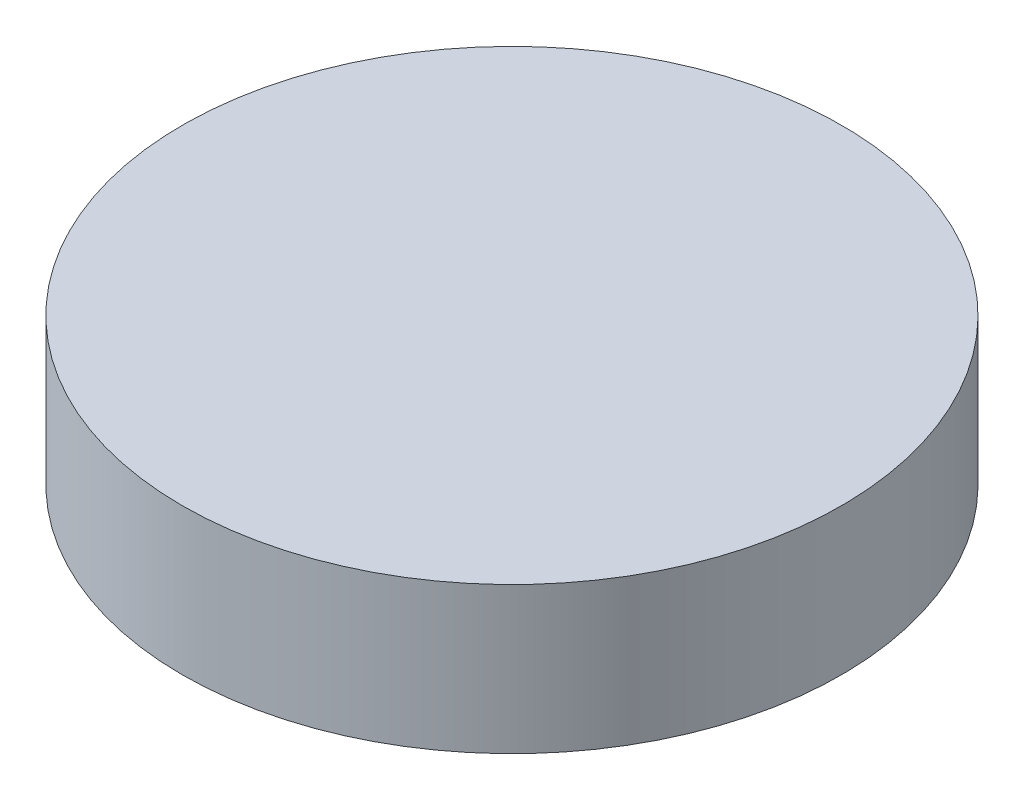
from build123d import *

# Parameters (mm, degrees)
SKETCH2_R           = 900
BOSS_EXTRUDE1_DEPTH = 400
SKETCH4_R           = 250
BOSS_EXTRUDE2_DEPTH = 50
SKETCH6_R           = 200
BOSS_EXTRUDE3_DEPTH = 400


with BuildPart() as part:
    # Sketch2 → Boss-Extrude1 (new body)
    with BuildSketch(Plane(origin=(0, 0, 0), x_dir=(1, 0, 0), z_dir=(0, 1, 0))):
        with Locations(Location((0, 0, 0), (0, 0, 270))):
            Circle(SKETCH2_R)
    extrude(amount=BOSS_EXTRUDE1_DEPTH)

    # Sketch4 → Boss-Extrude2 (add)
    with BuildSketch(Plane(origin=(0, 0, 0), x_dir=(-1, 0, 0), z_dir=(0, -1, 0))):
        with Locations(Location((0, 0, 0), (0, 0, 90))):
            Circle(SKETCH4_R)
    extrude(amount=BOSS_EXTRUDE2_DEPTH)

    # Sketch6 → Boss-Extrude3 (add)
    with BuildSketch(Plane(origin=(0, -50, 0), x_dir=(-1, 0, 0), z_dir=(0, -1, 0))):
        with Locations(Location((0, 0, 0), (0, 0, 90))):
            Circle(SKETCH6_R)
    extrude(amount=BOSS_EXTRUDE3_DEPTH)


solid = part.part
